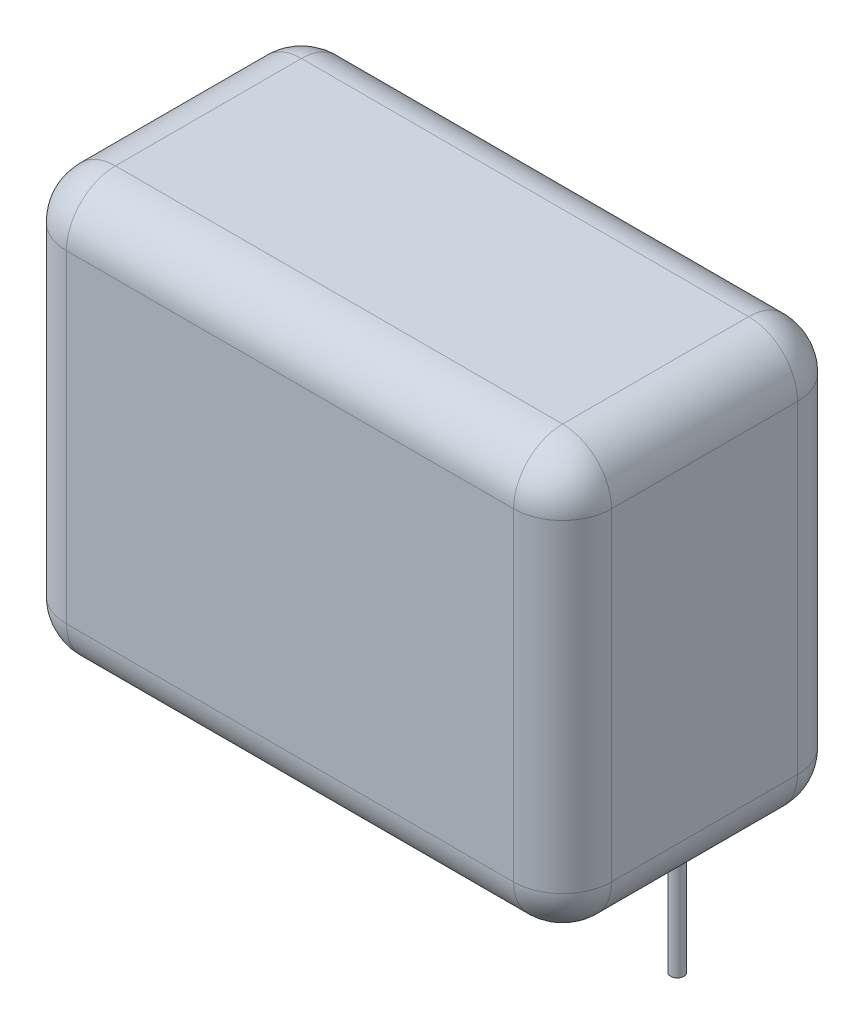
from build123d import *

# Parameters (mm, degrees)
BOSS_EXTRUDE1_DEPTH = 16.7
FILLET1_R           = 3
SKETCH2_R           = 0.4
BOSS_EXTRUDE2_DEPTH = 18.4
CUT_EXTRUDE1_DEPTH  = 0.01


with BuildPart() as part:
    # Sketch1 → Boss-Extrude1 (new, symmetric)
    with BuildSketch(Plane(origin=(0, 0, 0), x_dir=(0, 0, -1), z_dir=(1, 0, 0))):
        with BuildLine():
            Line((-5.7, 12.9), (5.7, 12.9))
            ThreePointArc((5.7, 12.9), (7.821320344, 12.021320344), (8.7, 9.9))
            Line((8.7, 9.9), (8.7, -9.9))
            ThreePointArc((8.7, -9.9), (7.821320344, -12.021320344), (5.7, -12.9))
            Line((5.7, -12.9), (-5.7, -12.9))
            ThreePointArc((-5.7, -12.9), (-7.821320344, -12.021320344), (-8.7, -9.9))
            Line((-8.7, -9.9), (-8.7, 9.9))
            ThreePointArc((-8.7, 9.9), (-7.821320344, 12.021320344), (-5.7, 12.9))
        make_face()
    extrude(amount=BOSS_EXTRUDE1_DEPTH, both=True)

    # Fillet1
    fillet1_edges = [part.edges().sort_by_distance(p)[0] for p in [
        (-16.7, 0, -8.7),
        (-16.7, -12.021320344, -7.821320344),
        (-16.7, -12.9, 0),
        (-16.7, -12.021320344, 7.821320344),
        (16.7, -12.021320344, -7.821320344),
        (16.7, 0, -8.7),
        (16.7, 12.021320344, -7.821320344),
        (16.7, 12.9, 0),
        (16.7, 12.021320344, 7.821320344),
        (16.7, 0, 8.7),
        (16.7, -12.021320344, 7.821320344),
        (-16.7, 0, 8.7),
        (16.7, -12.9, 0),
        (-16.7, 12.021320344, 7.821320344),
        (-16.7, 12.9, 0),
        (-16.7, 12.021320344, -7.821320344),
    ]]
    fillet(fillet1_edges, radius=FILLET1_R)

    # Sketch2 → Boss-Extrude2 (add)
    with BuildSketch(Plane(origin=(0, 0, 0), x_dir=(1, 0, 0), z_dir=(0, 1, 0))):
        with Locations(Location((15.03, 0, 0), (0, 0, 270))):
            Circle(SKETCH2_R)
        with Locations(Location((-15.03, 0, 0), (0, 0, 270))):
            Circle(SKETCH2_R)
    extrude(amount=-BOSS_EXTRUDE2_DEPTH)

    # Sketch5 → Cut-Extrude1 (cut)
    # profile 1 of 8: a face of its own
    with BuildSketch(Plane(origin=(0, 0, -8.7), x_dir=(-1, 0, 0), z_dir=(0, 0, -1))):
        Polygon((-11.059661053, 1.770961514), (-10.412525636, 1.770961514), (-10.412525636, -1.729038486), (-10.7266282, -1.729038486), (-10.7266282, 1.411987155), (-11.265089739, 1.411987155), align=None)
    # profile 2 of 8: a face of its own
    with BuildSketch(Plane(origin=(0, 0, -8.7), x_dir=(-1, 0, 0), z_dir=(0, 0, -1))):
        with BuildLine():
            add(Edge.make_bspline(
                [(-9.111243585, 0.019559271), (-9.110915567, 0.075656658), (-9.110278387, 0.184626643), (-9.103189966, 0.343411285), (-9.091414623, 0.492371574), (-9.075277251, 0.63151464), (-9.05563927, 0.760876404), (-9.029423784, 0.880111161), (-8.999610981, 0.989770768), (-8.965058535, 1.090212816), (-8.926070746, 1.182790519), (-8.883636486, 1.269215721), (-8.836071691, 1.349357653), (-8.786094778, 1.424495443), (-8.731682707, 1.493399138), (-8.674383916, 1.557041801), (-8.61196204, 1.613952551), (-8.546539032, 1.665798854), (-8.477522567, 1.711248325), (-8.406879901, 1.751281064), (-8.334124795, 1.785480931), (-8.259058612, 1.812371367), (-8.182356054, 1.834582214), (-8.103748988, 1.849771161), (-8.023107624, 1.85932807), (-7.968676189, 1.860241738), (-7.941071309, 1.860705104)],
                knots=[0, 0, 0, 0, 1.646270934, 3.197905019, 4.663502075, 6.030701355, 7.308322542, 8.50163776, 9.611534131, 10.641858119, 11.616356847, 12.558055219, 13.465016945, 14.349605745, 15.204443733, 16.039544428, 16.859896111, 17.680448484, 18.487036065, 19.28249412, 20.06191084, 20.843045899, 21.620316918, 22.403196591, 23.190181807, 24, 24, 24, 24], degree=3))
            add(Edge.make_bspline(
                [(-7.941071309, 1.860705104), (-7.913235831, 1.860217289), (-7.857879822, 1.859247178), (-7.776039447, 1.849923235), (-7.696089765, 1.834452112), (-7.618371626, 1.812531138), (-7.54224664, 1.785335461), (-7.468310232, 1.751248344), (-7.39610315, 1.711569476), (-7.326772863, 1.664945599), (-7.259558248, 1.612963323), (-7.196110285, 1.554200654), (-7.136423199, 1.489250935), (-7.079747893, 1.418809071), (-7.027692296, 1.341523986), (-6.978118864, 1.258739876), (-6.933746828, 1.169009012), (-6.891012153, 1.073828544), (-6.854125166, 0.970564885), (-6.820858921, 0.859800124), (-6.793979952, 0.740225938), (-6.77159068, 0.612469692), (-6.754245784, 0.476062209), (-6.741613142, 0.331295894), (-6.734940057, 0.178075503), (-6.733683356, 0.073317654), (-6.733038457, 0.019559271)],
                knots=[0, 0, 0, 0, 0.810914788, 1.612654377, 2.396697861, 3.181598691, 3.963628158, 4.749916497, 5.551656086, 6.361998678, 7.18212741, 8.025565596, 8.878627764, 9.750805457, 10.657531673, 11.591944965, 12.560506719, 13.57287815, 14.630710178, 15.753379473, 16.941251878, 18.199788006, 19.531962791, 20.947069417, 22.433333509, 24, 24, 24, 24], degree=3))
            add(Edge.make_bspline(
                [(-6.733038457, 0.019559271), (-6.733690041, -0.033964637), (-6.734959627, -0.138253789), (-6.741538334, -0.290784765), (-6.754496965, -0.434782808), (-6.770706953, -0.57059327), (-6.793157916, -0.697650889), (-6.820763083, -0.816395338), (-6.851413405, -0.927339409), (-6.8892482, -1.029574221), (-6.93065891, -1.124525944), (-6.975714106, -1.213193092), (-7.023983932, -1.296359385), (-7.076572677, -1.373359132), (-7.13262609, -1.444737789), (-7.193343879, -1.509235411), (-7.257014464, -1.568406083), (-7.32442688, -1.621057711), (-7.394838431, -1.667142515), (-7.466797508, -1.708356366), (-7.541580892, -1.741589061), (-7.617493844, -1.770124102), (-7.69562221, -1.791924554), (-7.775868601, -1.806998409), (-7.857824837, -1.817570258), (-7.913226402, -1.818376738), (-7.941071309, -1.818782076)],
                knots=[0, 0, 0, 0, 1.561518951, 3.042555995, 4.452378317, 5.7783523, 7.031515105, 8.214008947, 9.334062868, 10.386615937, 11.391082383, 12.354592575, 13.286541444, 14.194233754, 15.072674879, 15.931287219, 16.775624067, 17.606195743, 18.42308326, 19.229000347, 20.022332153, 20.807536673, 21.593273796, 22.3848459, 23.188221202, 24, 24, 24, 24], degree=3))
            add(Edge.make_bspline(
                [(-7.941071309, -1.818782076), (-7.968675423, -1.81831572), (-8.023105348, -1.817396158), (-8.103757773, -1.807882427), (-8.182040217, -1.792586923), (-8.258338971, -1.771170319), (-8.333045486, -1.744955483), (-8.405141773, -1.710801799), (-8.475429456, -1.671467731), (-8.543721012, -1.626672309), (-8.608733173, -1.575350626), (-8.670831779, -1.518586337), (-8.728456798, -1.454962926), (-8.782090893, -1.385485003), (-8.833064982, -1.310791761), (-8.879954355, -1.229863387), (-8.923325209, -1.143020777), (-8.9629687, -1.049702866), (-8.998117363, -0.948547938), (-9.029165071, -0.83839876), (-9.053679229, -0.718283124), (-9.074662184, -0.589165757), (-9.091586567, -0.450491826), (-9.103140892, -0.302186048), (-9.110282208, -0.144340839), (-9.110917278, -0.036071065), (-9.111243585, 0.019559271)],
                knots=[0, 0, 0, 0, 0.810891512, 1.598919785, 2.382837074, 3.152667961, 3.926044502, 4.706494248, 5.493654104, 6.291793342, 7.103789334, 7.925228297, 8.761435821, 9.622817696, 10.50288917, 11.416980706, 12.369136599, 13.353924996, 14.394355917, 15.514179734, 16.714354668, 17.994756427, 19.357759367, 20.818452758, 22.365282078, 24, 24, 24, 24], degree=3))
        make_face()
        with BuildLine():
            add(Edge.make_bspline(
                [(-8.797141021, 0.020961514), (-8.797021574, -0.025787185), (-8.79678975, -0.116517229), (-8.79073355, -0.24836049), (-8.782483318, -0.371330819), (-8.771842021, -0.485584356), (-8.756039072, -0.590734368), (-8.738332284, -0.687504051), (-8.716784195, -0.775381288), (-8.691289177, -0.854969099), (-8.66225008, -0.927618168), (-8.630544216, -0.995219383), (-8.596483493, -1.058571319), (-8.558364343, -1.117104928), (-8.51684928, -1.171011092), (-8.47287602, -1.221243924), (-8.424803436, -1.266040905), (-8.358299694, -1.31976776), (-8.270503219, -1.375286894), (-8.159882764, -1.423632984), (-8.046214313, -1.45401544), (-7.969063063, -1.457879196), (-7.930554482, -1.459807717)],
                knots=[0, 0, 0, 0, 1.459021318, 2.831673884, 4.118529203, 5.306027144, 6.411944654, 7.436330062, 8.375795394, 9.233974572, 10.042671642, 10.816086306, 11.563610507, 12.285937304, 12.993564865, 13.685989202, 14.367179055, 15.041617293, 16.353048772, 17.594441528, 18.799311195, 20, 20, 20, 20], degree=3))
            add(Edge.make_bspline(
                [(-7.930554482, -1.459807717), (-7.891796811, -1.458209936), (-7.814361487, -1.455017673), (-7.701227692, -1.424218936), (-7.591397422, -1.377749396), (-7.505325482, -1.322801891), (-7.439842938, -1.270473561), (-7.392925948, -1.225858913), (-7.3498639, -1.175903046), (-7.309021825, -1.12200375), (-7.271562749, -1.063131266), (-7.237499612, -0.99956869), (-7.206416264, -0.931139512), (-7.188707218, -0.883369773), (-7.17965304, -0.858946338)],
                knots=[0, 0, 0, 0, 1.353760809, 2.704726607, 4.075137775, 5.516104923, 6.260822281, 7.007110065, 7.778089737, 8.566572457, 9.372053459, 10.217411131, 11.088608312, 12, 12, 12, 12], degree=3))
            add(Edge.make_bspline(
                [(-7.17965304, -0.858946338), (-7.169101272, -0.827716599), (-7.147676658, -0.764306835), (-7.120064884, -0.665943183), (-7.098319485, -0.562740419), (-7.078756119, -0.455315302), (-7.065403063, -0.342875601), (-7.05465525, -0.225769217), (-7.048324563, -0.103907855), (-7.047539812, -0.021112864), (-7.047141021, 0.020961514)],
                knots=[0, 0, 0, 0, 0.884706709, 1.796334032, 2.740027952, 3.714592787, 4.726048262, 5.777819803, 6.87074269, 8, 8, 8, 8], degree=3))
            add(Edge.make_bspline(
                [(-7.047141021, 0.020961514), (-7.04769121, 0.063029087), (-7.048767498, 0.145322251), (-7.052881485, 0.265840432), (-7.06350506, 0.380308193), (-7.075304179, 0.489218666), (-7.0927014, 0.591968968), (-7.111459207, 0.689419274), (-7.136660419, 0.780362298), (-7.163580194, 0.86622188), (-7.19439059, 0.946022535), (-7.228306324, 1.020136321), (-7.264528083, 1.088921046), (-7.303870323, 1.152187987), (-7.345866006, 1.21022053), (-7.391623555, 1.261855125), (-7.439327928, 1.308692093), (-7.506145114, 1.362154662), (-7.593619404, 1.416666358), (-7.702465051, 1.466832117), (-7.815735695, 1.49564041), (-7.892309149, 1.499702097), (-7.930554482, 1.501730745)],
                knots=[0, 0, 0, 0, 1.31362396, 2.569729283, 3.763502607, 4.902122613, 5.988968491, 7.01645872, 7.998833611, 8.933434873, 9.825090667, 10.667526885, 11.477055099, 12.250526234, 12.991942729, 13.710640831, 14.402115721, 15.076753259, 16.378508321, 17.609869233, 18.806226677, 20, 20, 20, 20], degree=3))
            add(Edge.make_bspline(
                [(-7.930554482, 1.501730745), (-7.969265074, 1.499699298), (-8.04675678, 1.495632704), (-8.161204735, 1.466939451), (-8.270909086, 1.416926485), (-8.358152061, 1.361974112), (-8.425015848, 1.309635801), (-8.472098541, 1.264249347), (-8.516244713, 1.214603092), (-8.556912413, 1.160201177), (-8.595001696, 1.10173581), (-8.629982709, 1.038747045), (-8.661500039, 0.970915681), (-8.690584575, 0.898299246), (-8.716157363, 0.818718301), (-8.737251326, 0.730949308), (-8.756738379, 0.634487416), (-8.770533648, 0.528767908), (-8.782797404, 0.414485755), (-8.790678752, 0.291208436), (-8.796810009, 0.159144056), (-8.797028474, 0.067944898), (-8.797141021, 0.020961514)],
                knots=[0, 0, 0, 0, 1.207732386, 2.417664972, 3.655092373, 4.956220595, 5.625982001, 6.301752483, 6.994047911, 7.697131622, 8.419323945, 9.170223765, 9.943494443, 10.752040957, 11.610060368, 12.549350801, 13.567764191, 14.679664412, 15.874934091, 17.154273443, 18.533957287, 20, 20, 20, 20], degree=3))
        make_face(mode=Mode.SUBTRACT)
    # profile 3 of 8: a face of its own
    with BuildSketch(Plane(origin=(0, 0, -8.7), x_dir=(-1, 0, 0), z_dir=(0, 0, -1))):
        with BuildLine():
            Line((-6.239448713, 0.828653822), (-5.925346149, 0.828653822))
            Line((-5.925346149, 0.828653822), (-5.925346149, -0.357644255))
            add(Edge.make_bspline(
                [(-5.925346149, -0.357644255), (-5.925204244, -0.392467004), (-5.924932787, -0.459081292), (-5.923091846, -0.554936479), (-5.918761752, -0.642353192), (-5.913347928, -0.721381928), (-5.906385791, -0.79200932), (-5.898102431, -0.853988677), (-5.888844009, -0.908022861), (-5.879781295, -0.940566217), (-5.875566502, -0.955701146)],
                knots=[0, 0, 0, 0, 1.388932606, 2.656963016, 3.823490214, 4.879454478, 5.816252168, 6.653371382, 7.373723809, 8, 8, 8, 8], degree=3))
            add(Edge.make_bspline(
                [(-5.875566502, -0.955701146), (-5.868805047, -0.974724017), (-5.855422706, -1.012374278), (-5.831149222, -1.066763283), (-5.801120885, -1.117138566), (-5.768261057, -1.165442639), (-5.73036165, -1.210244625), (-5.687902179, -1.251468869), (-5.642303942, -1.29067296), (-5.574548918, -1.337057752), (-5.481889652, -1.386773082), (-5.360236897, -1.429668901), (-5.228332671, -1.455304721), (-5.137167952, -1.458278976), (-5.090310091, -1.459807717)],
                knots=[0, 0, 0, 0, 0.725840625, 1.436591201, 2.137033971, 2.831655856, 3.53531722, 4.242432219, 4.957935707, 5.694543706, 7.190802206, 8.724350549, 10.316345118, 12, 12, 12, 12], degree=3))
            add(Edge.make_bspline(
                [(-5.090310091, -1.459807717), (-5.043456584, -1.458246468), (-4.952803715, -1.455225741), (-4.822348746, -1.430442202), (-4.703097332, -1.389036513), (-4.59624638, -1.331229101), (-4.50228054, -1.260487039), (-4.423976121, -1.17747823), (-4.359368867, -1.084828843), (-4.331159446, -1.015704564), (-4.316972752, -0.980941531)],
                knots=[0, 0, 0, 0, 1.157059328, 2.238695713, 3.266970494, 4.264342957, 5.228770407, 6.160125903, 7.074715775, 8, 8, 8, 8], degree=3))
            add(Edge.make_bspline(
                [(-4.316972752, -0.980941531), (-4.312778521, -0.966975232), (-4.303506103, -0.936099157), (-4.293543752, -0.883719408), (-4.28456929, -0.821254804), (-4.276906114, -0.748296595), (-4.271440951, -0.665035443), (-4.268494925, -0.571497366), (-4.265166649, -0.467976006), (-4.265116133, -0.395508247), (-4.265089739, -0.357644255)],
                knots=[0, 0, 0, 0, 0.557542046, 1.232589297, 2.036731608, 2.971723315, 4.038036528, 5.22795436, 6.551621927, 8, 8, 8, 8], degree=3))
            Line((-4.265089739, -0.357644255), (-4.265089739, 0.828653822))
            Line((-4.265089739, 0.828653822), (-3.950987175, 0.828653822))
            Line((-3.950987175, 0.828653822), (-3.950987175, -0.416538486))
            add(Edge.make_bspline(
                [(-3.950987175, -0.416538486), (-3.951428869, -0.458845657), (-3.952285818, -0.540927357), (-3.957793161, -0.660211469), (-3.967242774, -0.771373714), (-3.981585459, -0.874472933), (-3.998451134, -0.969430415), (-4.020207406, -1.056367861), (-4.046185644, -1.135017415), (-4.075491159, -1.206759192), (-4.110113027, -1.271806086), (-4.146940047, -1.333541903), (-4.189464819, -1.390434838), (-4.234235053, -1.445316975), (-4.284036709, -1.495458503), (-4.337936568, -1.542009978), (-4.395175988, -1.58568301), (-4.457025186, -1.62477429), (-4.522581249, -1.659990935), (-4.591925106, -1.691207013), (-4.665906104, -1.71590959), (-4.743569741, -1.737220256), (-4.82529652, -1.753934725), (-4.911007654, -1.765721292), (-5.00067427, -1.772946623), (-5.06178373, -1.773583668), (-5.093114578, -1.773910281)],
                knots=[0, 0, 0, 0, 1.493040784, 2.896703357, 4.213163133, 5.428574705, 6.569057535, 7.615249723, 8.588095153, 9.490268104, 10.346124644, 11.18633936, 12.024365274, 12.850166724, 13.684164916, 14.514361689, 15.362232829, 16.222528818, 17.093394965, 17.986930858, 18.902426812, 19.842810585, 20.827885679, 21.843828298, 22.894529745, 24, 24, 24, 24], degree=3))
            add(Edge.make_bspline(
                [(-5.093114578, -1.773910281), (-5.124211093, -1.773570574), (-5.185318638, -1.772903017), (-5.274989882, -1.76576121), (-5.360938488, -1.753953039), (-5.442858887, -1.737097822), (-5.520833284, -1.716058752), (-5.595177524, -1.691055216), (-5.665021087, -1.659974735), (-5.731203091, -1.624997177), (-5.793205479, -1.585431902), (-5.851314057, -1.542063862), (-5.90545091, -1.494957799), (-5.955627978, -1.444310442), (-6.001140954, -1.389493505), (-6.042556996, -1.330947945), (-6.080513701, -1.269253857), (-6.114866492, -1.203190694), (-6.144378247, -1.130618684), (-6.170433493, -1.050321587), (-6.191744131, -0.96141907), (-6.2090866, -0.863987142), (-6.22303804, -0.7584921), (-6.232724183, -0.644323685), (-6.238140013, -0.521759993), (-6.239003075, -0.437110103), (-6.239448713, -0.393401467)],
                knots=[0, 0, 0, 0, 1.083640291, 2.129454052, 3.13281866, 4.105697902, 5.042300162, 5.946461698, 6.836384745, 7.703652036, 8.553297018, 9.397182691, 10.228592656, 11.052265423, 11.879314572, 12.708807002, 13.549817954, 14.402308542, 15.300838682, 16.27712199, 17.341985831, 18.484375296, 19.725102775, 21.0496083, 22.476576903, 24, 24, 24, 24], degree=3))
            Line((-6.239448713, -0.393401467), (-6.239448713, 0.828653822))
        make_face()
    # profile 4 of 8: a face of its own
    with BuildSketch(Plane(origin=(0, 0, -8.7), x_dir=(-1, 0, 0), z_dir=(0, 0, -1))):
        Polygon((-3.143294867, 1.770961514), (-1.438166662, 1.770961514), (-1.438166662, 1.411987155), (-2.829192303, 1.411987155), (-2.829192303, 0.335064078), (-1.438166662, 0.335064078), (-1.438166662, -0.023910281), (-2.829192303, -0.023910281), (-2.829192303, -1.729038486), (-3.143294867, -1.729038486), align=None)
    # profile 5 of 8: a face of its own
    with BuildSketch(Plane(origin=(0, 0, -8.7), x_dir=(-1, 0, 0), z_dir=(0, 0, -1))):
        Polygon((2.132646639, 1.860705104), (2.196448723, 1.860705104), (2.196448723, -0.562371819), (2.600294877, -0.562371819), (2.600294877, -0.921346178), (2.196448723, -0.921346178), (2.196448723, -1.729038486), (1.882346159, -1.729038486), (1.882346159, -0.921346178), (0.222089748, -0.921346178), align=None)
        Polygon((1.882346159, -0.562371819), (1.882346159, 0.957660232), (0.839076928, -0.562371819), align=None, mode=Mode.SUBTRACT)
    # profile 6 of 8: a face of its own
    with BuildSketch(Plane(origin=(0, 0, -8.7), x_dir=(-1, 0, 0), z_dir=(0, 0, -1))):
        with BuildLine():
            add(Edge.make_bspline(
                [(2.914397441, 0.019559271), (2.914725459, 0.075656658), (2.915362639, 0.184626643), (2.92245106, 0.343411285), (2.934226402, 0.492371574), (2.950363775, 0.63151464), (2.970001755, 0.760876404), (2.996217242, 0.880111161), (3.026030044, 0.989770768), (3.06058249, 1.090212816), (3.099570279, 1.182790519), (3.14200454, 1.269215721), (3.189569334, 1.349357653), (3.239546247, 1.424495443), (3.293958319, 1.493399138), (3.351257109, 1.557041801), (3.413678986, 1.613952551), (3.479101994, 1.665798854), (3.548118458, 1.711248325), (3.618761125, 1.751281064), (3.69151623, 1.785480931), (3.766582413, 1.812371367), (3.843284971, 1.834582214), (3.921892038, 1.849771161), (4.002533402, 1.85932807), (4.056964837, 1.860241738), (4.084569716, 1.860705104)],
                knots=[0, 0, 0, 0, 1.646270934, 3.197905019, 4.663502075, 6.030701355, 7.308322542, 8.50163776, 9.611534131, 10.641858119, 11.616356847, 12.558055219, 13.465016945, 14.349605745, 15.204443733, 16.039544428, 16.859896111, 17.680448484, 18.487036065, 19.28249412, 20.06191084, 20.843045899, 21.620316918, 22.403196591, 23.190181807, 24, 24, 24, 24], degree=3))
            add(Edge.make_bspline(
                [(4.084569716, 1.860705104), (4.112405195, 1.860217289), (4.167761204, 1.859247178), (4.249601579, 1.849923235), (4.329551261, 1.834452112), (4.407269399, 1.812531138), (4.483394386, 1.785335461), (4.557330794, 1.751248344), (4.629537875, 1.711569476), (4.698868163, 1.664945599), (4.766082778, 1.612963323), (4.829530741, 1.554200654), (4.889217827, 1.489250935), (4.945893132, 1.418809071), (4.99794873, 1.341523986), (5.047522162, 1.258739876), (5.091894198, 1.169009012), (5.134628873, 1.073828544), (5.17151586, 0.970564885), (5.204782105, 0.859800124), (5.231661073, 0.740225938), (5.254050346, 0.612469692), (5.271395242, 0.476062209), (5.284027884, 0.331295894), (5.290700969, 0.178075503), (5.29195767, 0.073317654), (5.292602569, 0.019559271)],
                knots=[0, 0, 0, 0, 0.810914788, 1.612654377, 2.396697861, 3.181598691, 3.963628158, 4.749916497, 5.551656086, 6.361998678, 7.18212741, 8.025565596, 8.878627764, 9.750805457, 10.657531673, 11.591944965, 12.560506719, 13.57287815, 14.630710178, 15.753379473, 16.941251878, 18.199788006, 19.531962791, 20.947069417, 22.433333509, 24, 24, 24, 24], degree=3))
            add(Edge.make_bspline(
                [(5.292602569, 0.019559271), (5.291950984, -0.033964637), (5.290681399, -0.138253789), (5.284102692, -0.290784765), (5.271144061, -0.434782808), (5.254934072, -0.57059327), (5.232483109, -0.697650889), (5.204877943, -0.816395338), (5.17422762, -0.927339409), (5.136392826, -1.029574221), (5.094982116, -1.124525944), (5.04992692, -1.213193092), (5.001657093, -1.296359385), (4.949068348, -1.373359132), (4.893014935, -1.444737789), (4.832297146, -1.509235411), (4.768626561, -1.568406083), (4.701214146, -1.621057711), (4.630802594, -1.667142515), (4.558843517, -1.708356366), (4.484060134, -1.741589061), (4.408147181, -1.770124102), (4.330018815, -1.791924554), (4.249772425, -1.806998409), (4.167816189, -1.817570258), (4.112414624, -1.818376738), (4.084569716, -1.818782076)],
                knots=[0, 0, 0, 0, 1.561518951, 3.042555995, 4.452378317, 5.7783523, 7.031515105, 8.214008947, 9.334062868, 10.386615937, 11.391082383, 12.354592575, 13.286541444, 14.194233754, 15.072674879, 15.931287219, 16.775624067, 17.606195743, 18.42308326, 19.229000347, 20.022332153, 20.807536673, 21.593273796, 22.3848459, 23.188221202, 24, 24, 24, 24], degree=3))
            add(Edge.make_bspline(
                [(4.084569716, -1.818782076), (4.056965602, -1.81831572), (4.002535678, -1.817396158), (3.921883252, -1.807882427), (3.843600809, -1.792586923), (3.767302055, -1.771170319), (3.69259554, -1.744955483), (3.620499253, -1.710801799), (3.550211569, -1.671467731), (3.481920013, -1.626672309), (3.416907852, -1.575350626), (3.354809247, -1.518586337), (3.297184228, -1.454962926), (3.243550132, -1.385485003), (3.192576044, -1.310791761), (3.145686671, -1.229863387), (3.102315817, -1.143020777), (3.062672326, -1.049702866), (3.027523662, -0.948547938), (2.996475954, -0.83839876), (2.971961797, -0.718283124), (2.950978842, -0.589165757), (2.934054458, -0.450491826), (2.922500133, -0.302186048), (2.915358818, -0.144340839), (2.914723748, -0.036071065), (2.914397441, 0.019559271)],
                knots=[0, 0, 0, 0, 0.810891512, 1.598919785, 2.382837074, 3.152667961, 3.926044502, 4.706494248, 5.493654104, 6.291793342, 7.103789334, 7.925228297, 8.761435821, 9.622817696, 10.50288917, 11.416980706, 12.369136599, 13.353924996, 14.394355917, 15.514179734, 16.714354668, 17.994756427, 19.357759367, 20.818452758, 22.365282078, 24, 24, 24, 24], degree=3))
        make_face()
        with BuildLine():
            add(Edge.make_bspline(
                [(3.228500005, 0.020961514), (3.228619452, -0.025787185), (3.228851275, -0.116517229), (3.234907476, -0.24836049), (3.243157708, -0.371330819), (3.253799005, -0.485584356), (3.269601954, -0.590734368), (3.287308741, -0.687504051), (3.308856831, -0.775381288), (3.334351849, -0.854969099), (3.363390946, -0.927618168), (3.395096809, -0.995219383), (3.429157532, -1.058571319), (3.467276683, -1.117104928), (3.508791746, -1.171011092), (3.552765005, -1.221243924), (3.600837589, -1.266040905), (3.667341332, -1.31976776), (3.755137806, -1.375286894), (3.865758262, -1.423632984), (3.979426713, -1.45401544), (4.056577963, -1.457879196), (4.095086543, -1.459807717)],
                knots=[0, 0, 0, 0, 1.459021318, 2.831673884, 4.118529203, 5.306027144, 6.411944654, 7.436330062, 8.375795394, 9.233974572, 10.042671642, 10.816086306, 11.563610507, 12.285937304, 12.993564865, 13.685989202, 14.367179055, 15.041617293, 16.353048772, 17.594441528, 18.799311195, 20, 20, 20, 20], degree=3))
            add(Edge.make_bspline(
                [(4.095086543, -1.459807717), (4.133844215, -1.458209936), (4.211279538, -1.455017673), (4.324413333, -1.424218936), (4.434243603, -1.377749396), (4.520315544, -1.322801891), (4.585798087, -1.270473561), (4.632715077, -1.225858913), (4.675777126, -1.175903046), (4.716619201, -1.12200375), (4.754078276, -1.063131266), (4.788141414, -0.99956869), (4.819224761, -0.931139512), (4.836933807, -0.883369773), (4.845987986, -0.858946338)],
                knots=[0, 0, 0, 0, 1.353760809, 2.704726607, 4.075137775, 5.516104923, 6.260822281, 7.007110065, 7.778089737, 8.566572457, 9.372053459, 10.217411131, 11.088608312, 12, 12, 12, 12], degree=3))
            add(Edge.make_bspline(
                [(4.845987986, -0.858946338), (4.856539753, -0.827716599), (4.877964367, -0.764306835), (4.905576142, -0.665943183), (4.927321541, -0.562740419), (4.946884906, -0.455315302), (4.960237962, -0.342875601), (4.970985776, -0.225769217), (4.977316463, -0.103907855), (4.978101214, -0.021112864), (4.978500005, 0.020961514)],
                knots=[0, 0, 0, 0, 0.884706709, 1.796334032, 2.740027952, 3.714592787, 4.726048262, 5.777819803, 6.87074269, 8, 8, 8, 8], degree=3))
            add(Edge.make_bspline(
                [(4.978500005, 0.020961514), (4.977949816, 0.063029087), (4.976873528, 0.145322251), (4.97275954, 0.265840432), (4.962135966, 0.380308193), (4.950336847, 0.489218666), (4.932939626, 0.591968968), (4.914181819, 0.689419274), (4.888980607, 0.780362298), (4.862060832, 0.86622188), (4.831250436, 0.946022535), (4.797334702, 1.020136321), (4.761112943, 1.088921046), (4.721770703, 1.152187987), (4.679775019, 1.21022053), (4.63401747, 1.261855125), (4.586313097, 1.308692093), (4.519495912, 1.362154662), (4.432021622, 1.416666358), (4.323175975, 1.466832117), (4.20990533, 1.49564041), (4.133331876, 1.499702097), (4.095086543, 1.501730745)],
                knots=[0, 0, 0, 0, 1.31362396, 2.569729283, 3.763502607, 4.902122613, 5.988968491, 7.01645872, 7.998833611, 8.933434873, 9.825090667, 10.667526885, 11.477055099, 12.250526234, 12.991942729, 13.710640831, 14.402115721, 15.076753259, 16.378508321, 17.609869233, 18.806226677, 20, 20, 20, 20], degree=3))
            add(Edge.make_bspline(
                [(4.095086543, 1.501730745), (4.056375951, 1.499699298), (3.978884246, 1.495632704), (3.864436291, 1.466939451), (3.754731939, 1.416926485), (3.667488965, 1.361974112), (3.600625178, 1.309635801), (3.553542485, 1.264249347), (3.509396312, 1.214603092), (3.468728612, 1.160201177), (3.430639329, 1.10173581), (3.395658317, 1.038747045), (3.364140987, 0.970915681), (3.335056451, 0.898299246), (3.309483663, 0.818718301), (3.288389699, 0.730949308), (3.268902646, 0.634487416), (3.255107377, 0.528767908), (3.242843622, 0.414485755), (3.234962274, 0.291208436), (3.228831016, 0.159144056), (3.228612552, 0.067944898), (3.228500005, 0.020961514)],
                knots=[0, 0, 0, 0, 1.207732386, 2.417664972, 3.655092373, 4.956220595, 5.625982001, 6.301752483, 6.994047911, 7.697131622, 8.419323945, 9.170223765, 9.943494443, 10.752040957, 11.610060368, 12.549350801, 13.567764191, 14.679664412, 15.874934091, 17.154273443, 18.533957287, 20, 20, 20, 20], degree=3))
        make_face(mode=Mode.SUBTRACT)
    # profile 7 of 8: a face of its own
    with BuildSketch(Plane(origin=(0, 0, -8.7), x_dir=(-1, 0, 0), z_dir=(0, 0, -1))):
        with BuildLine():
            add(Edge.make_bspline(
                [(5.606705133, 0.019559271), (5.607033151, 0.075656658), (5.607670331, 0.184626643), (5.614758752, 0.343411285), (5.626534094, 0.492371574), (5.642671467, 0.63151464), (5.662309448, 0.760876404), (5.688524934, 0.880111161), (5.718337737, 0.989770768), (5.752890183, 1.090212816), (5.791877972, 1.182790519), (5.834312232, 1.269215721), (5.881877027, 1.349357653), (5.93185394, 1.424495443), (5.986266011, 1.493399138), (6.043564802, 1.557041801), (6.105986678, 1.613952551), (6.171409686, 1.665798854), (6.240426151, 1.711248325), (6.311068817, 1.751281064), (6.383823923, 1.785480931), (6.458890106, 1.812371367), (6.535592663, 1.834582214), (6.61419973, 1.849771161), (6.694841094, 1.85932807), (6.749272529, 1.860241738), (6.776877409, 1.860705104)],
                knots=[0, 0, 0, 0, 1.646270934, 3.197905019, 4.663502075, 6.030701355, 7.308322542, 8.50163776, 9.611534131, 10.641858119, 11.616356847, 12.558055219, 13.465016945, 14.349605745, 15.204443733, 16.039544428, 16.859896111, 17.680448484, 18.487036065, 19.28249412, 20.06191084, 20.843045899, 21.620316918, 22.403196591, 23.190181807, 24, 24, 24, 24], degree=3))
            add(Edge.make_bspline(
                [(6.776877409, 1.860705104), (6.804712887, 1.860217289), (6.860068896, 1.859247178), (6.941909271, 1.849923235), (7.021858953, 1.834452112), (7.099577092, 1.812531138), (7.175702078, 1.785335461), (7.249638486, 1.751248344), (7.321845568, 1.711569476), (7.391175855, 1.664945599), (7.45839047, 1.612963323), (7.521838433, 1.554200654), (7.581525519, 1.489250935), (7.638200825, 1.418809071), (7.690256422, 1.341523986), (7.739829854, 1.258739876), (7.78420189, 1.169009012), (7.826936565, 1.073828544), (7.863823552, 0.970564885), (7.897089797, 0.859800124), (7.923968766, 0.740225938), (7.946358038, 0.612469692), (7.963702934, 0.476062209), (7.976335576, 0.331295894), (7.983008661, 0.178075503), (7.984265362, 0.073317654), (7.984910261, 0.019559271)],
                knots=[0, 0, 0, 0, 0.810914788, 1.612654377, 2.396697861, 3.181598691, 3.963628158, 4.749916497, 5.551656086, 6.361998678, 7.18212741, 8.025565596, 8.878627764, 9.750805457, 10.657531673, 11.591944965, 12.560506719, 13.57287815, 14.630710178, 15.753379473, 16.941251878, 18.199788006, 19.531962791, 20.947069417, 22.433333509, 24, 24, 24, 24], degree=3))
            add(Edge.make_bspline(
                [(7.984910261, 0.019559271), (7.984258677, -0.033964637), (7.982989091, -0.138253789), (7.976410384, -0.290784765), (7.963451753, -0.434782808), (7.947241765, -0.57059327), (7.924790802, -0.697650889), (7.897185635, -0.816395338), (7.866535313, -0.927339409), (7.828700518, -1.029574221), (7.787289808, -1.124525944), (7.742234612, -1.213193092), (7.693964786, -1.296359385), (7.641376041, -1.373359132), (7.585322628, -1.444737789), (7.524604839, -1.509235411), (7.460934254, -1.568406083), (7.393521838, -1.621057711), (7.323110287, -1.667142515), (7.25115121, -1.708356366), (7.176367826, -1.741589061), (7.100454874, -1.770124102), (7.022326508, -1.791924554), (6.942080117, -1.806998409), (6.860123881, -1.817570258), (6.804722316, -1.818376738), (6.776877409, -1.818782076)],
                knots=[0, 0, 0, 0, 1.561518951, 3.042555995, 4.452378317, 5.7783523, 7.031515105, 8.214008947, 9.334062868, 10.386615937, 11.391082383, 12.354592575, 13.286541444, 14.194233754, 15.072674879, 15.931287219, 16.775624067, 17.606195743, 18.42308326, 19.229000347, 20.022332153, 20.807536673, 21.593273796, 22.3848459, 23.188221202, 24, 24, 24, 24], degree=3))
            add(Edge.make_bspline(
                [(6.776877409, -1.818782076), (6.749273295, -1.81831572), (6.69484337, -1.817396158), (6.614190945, -1.807882427), (6.535908501, -1.792586923), (6.459609747, -1.771170319), (6.384903232, -1.744955483), (6.312806945, -1.710801799), (6.242519262, -1.671467731), (6.174227706, -1.626672309), (6.109215545, -1.575350626), (6.047116939, -1.518586337), (5.98949192, -1.454962926), (5.935857825, -1.385485003), (5.884883736, -1.310791761), (5.837994363, -1.229863387), (5.794623509, -1.143020777), (5.754980018, -1.049702866), (5.719831355, -0.948547938), (5.688783647, -0.83839876), (5.664269489, -0.718283124), (5.643286534, -0.589165757), (5.626362151, -0.450491826), (5.614807825, -0.302186048), (5.60766651, -0.144340839), (5.60703144, -0.036071065), (5.606705133, 0.019559271)],
                knots=[0, 0, 0, 0, 0.810891512, 1.598919785, 2.382837074, 3.152667961, 3.926044502, 4.706494248, 5.493654104, 6.291793342, 7.103789334, 7.925228297, 8.761435821, 9.622817696, 10.50288917, 11.416980706, 12.369136599, 13.353924996, 14.394355917, 15.514179734, 16.714354668, 17.994756427, 19.357759367, 20.818452758, 22.365282078, 24, 24, 24, 24], degree=3))
        make_face()
        with BuildLine():
            add(Edge.make_bspline(
                [(5.920807697, 0.020961514), (5.920927144, -0.025787185), (5.921158968, -0.116517229), (5.927215168, -0.24836049), (5.9354654, -0.371330819), (5.946106697, -0.485584356), (5.961909646, -0.590734368), (5.979616434, -0.687504051), (6.001164523, -0.775381288), (6.026659541, -0.854969099), (6.055698638, -0.927618168), (6.087404502, -0.995219383), (6.121465225, -1.058571319), (6.159584375, -1.117104928), (6.201099438, -1.171011092), (6.245072698, -1.221243924), (6.293145282, -1.266040905), (6.359649024, -1.31976776), (6.447445499, -1.375286894), (6.558065954, -1.423632984), (6.671734405, -1.45401544), (6.748885655, -1.457879196), (6.787394236, -1.459807717)],
                knots=[0, 0, 0, 0, 1.459021318, 2.831673884, 4.118529203, 5.306027144, 6.411944654, 7.436330062, 8.375795394, 9.233974572, 10.042671642, 10.816086306, 11.563610507, 12.285937304, 12.993564865, 13.685989202, 14.367179055, 15.041617293, 16.353048772, 17.594441528, 18.799311195, 20, 20, 20, 20], degree=3))
            add(Edge.make_bspline(
                [(6.787394236, -1.459807717), (6.826151907, -1.458209936), (6.90358723, -1.455017673), (7.016721026, -1.424218936), (7.126551296, -1.377749396), (7.212623236, -1.322801891), (7.278105779, -1.270473561), (7.32502277, -1.225858913), (7.368084818, -1.175903046), (7.408926893, -1.12200375), (7.446385969, -1.063131266), (7.480449106, -0.99956869), (7.511532454, -0.931139512), (7.5292415, -0.883369773), (7.538295678, -0.858946338)],
                knots=[0, 0, 0, 0, 1.353760809, 2.704726607, 4.075137775, 5.516104923, 6.260822281, 7.007110065, 7.778089737, 8.566572457, 9.372053459, 10.217411131, 11.088608312, 12, 12, 12, 12], degree=3))
            add(Edge.make_bspline(
                [(7.538295678, -0.858946338), (7.548847446, -0.827716599), (7.57027206, -0.764306835), (7.597883834, -0.665943183), (7.619629233, -0.562740419), (7.639192599, -0.455315302), (7.652545655, -0.342875601), (7.663293468, -0.225769217), (7.669624155, -0.103907855), (7.670408906, -0.021112864), (7.670807697, 0.020961514)],
                knots=[0, 0, 0, 0, 0.884706709, 1.796334032, 2.740027952, 3.714592787, 4.726048262, 5.777819803, 6.87074269, 8, 8, 8, 8], degree=3))
            add(Edge.make_bspline(
                [(7.670807697, 0.020961514), (7.670257508, 0.063029087), (7.66918122, 0.145322251), (7.665067232, 0.265840432), (7.654443658, 0.380308193), (7.642644539, 0.489218666), (7.625247318, 0.591968968), (7.606489511, 0.689419274), (7.581288299, 0.780362298), (7.554368524, 0.86622188), (7.523558128, 0.946022535), (7.489642394, 1.020136321), (7.453420635, 1.088921046), (7.414078395, 1.152187987), (7.372082712, 1.21022053), (7.326325163, 1.261855125), (7.27862079, 1.308692093), (7.211803604, 1.362154662), (7.124329314, 1.416666358), (7.015483667, 1.466832117), (6.902213023, 1.49564041), (6.825639568, 1.499702097), (6.787394236, 1.501730745)],
                knots=[0, 0, 0, 0, 1.31362396, 2.569729283, 3.763502607, 4.902122613, 5.988968491, 7.01645872, 7.998833611, 8.933434873, 9.825090667, 10.667526885, 11.477055099, 12.250526234, 12.991942729, 13.710640831, 14.402115721, 15.076753259, 16.378508321, 17.609869233, 18.806226677, 20, 20, 20, 20], degree=3))
            add(Edge.make_bspline(
                [(6.787394236, 1.501730745), (6.748683644, 1.499699298), (6.671191938, 1.495632704), (6.556743983, 1.466939451), (6.447039632, 1.416926485), (6.359796657, 1.361974112), (6.29293287, 1.309635801), (6.245850177, 1.264249347), (6.201704005, 1.214603092), (6.161036305, 1.160201177), (6.122947021, 1.10173581), (6.087966009, 1.038747045), (6.056448679, 0.970915681), (6.027364143, 0.898299246), (6.001791355, 0.818718301), (5.980697392, 0.730949308), (5.961210339, 0.634487416), (5.94741507, 0.528767908), (5.935151314, 0.414485755), (5.927269966, 0.291208436), (5.921138709, 0.159144056), (5.920920244, 0.067944898), (5.920807697, 0.020961514)],
                knots=[0, 0, 0, 0, 1.207732386, 2.417664972, 3.655092373, 4.956220595, 5.625982001, 6.301752483, 6.994047911, 7.697131622, 8.419323945, 9.170223765, 9.943494443, 10.752040957, 11.610060368, 12.549350801, 13.567764191, 14.679664412, 15.874934091, 17.154273443, 18.533957287, 20, 20, 20, 20], degree=3))
        make_face(mode=Mode.SUBTRACT)
    # profile 8 of 8: a face of its own
    with BuildSketch(Plane(origin=(0, 0, -8.7), x_dir=(-1, 0, 0), z_dir=(0, 0, -1))):
        Polygon((8.34388462, 1.770961514), (8.680423082, 1.770961514), (9.847089748, -0.987251627), (11.013756415, 1.770961514), (11.350294877, 1.770961514), (9.869525646, -1.729038486), (9.824653851, -1.729038486), align=None)
    extrude(amount=-CUT_EXTRUDE1_DEPTH, mode=Mode.SUBTRACT)


solid = part.part
